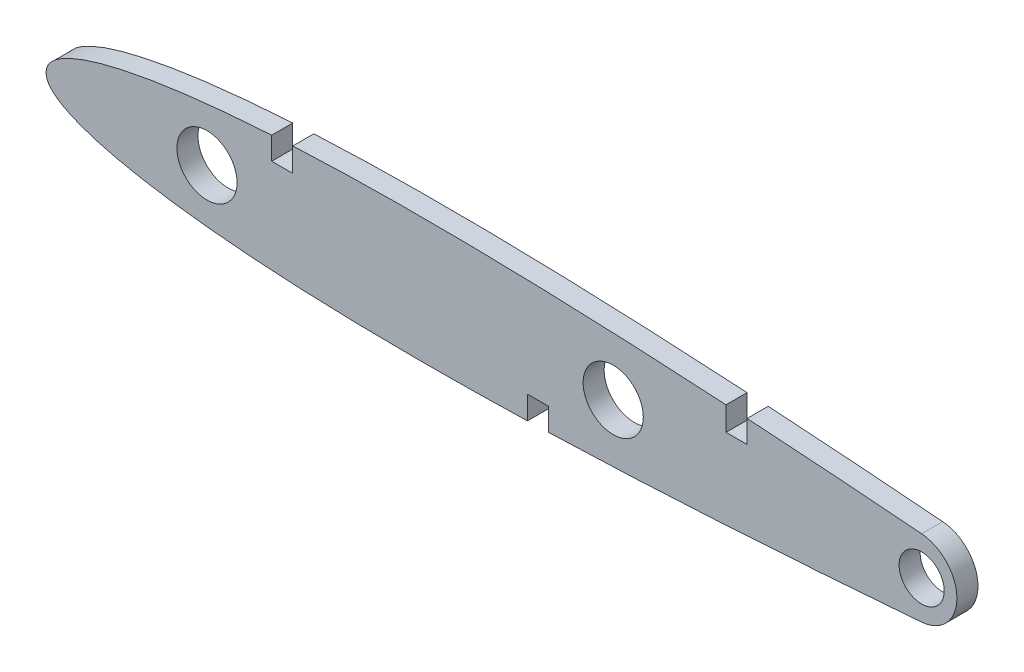
from build123d import *

# Parameters (mm, degrees)
SKETCH_1_R      = 4
SKETCH_1_R_2    = 3
EXTRUDE_1_DEPTH = 1.4


with BuildPart() as part:
    # Эскиз1 → Бобышка-Вытянуть1 (new, symmetric)
    # profile 1 of 3: a face of its own
    with BuildSketch(Plane.XY):
        with BuildLine():
            ThreePointArc((142.879654521, -5.645889143), (140.91290042, 0), (142.879654521, 5.645889143))
            add(Edge.make_bspline(
                [(142.879654521, 5.645889143), (142.747268556, 5.655935735), (140.983089587, 5.789556497), (137.585492165, 6.040187447), (132.68922042, 6.382393711), (129.093359344, 6.61888416), (127.131231234, 6.742693318), (126.8, 6.763442063)],
                knots=[0.339950039, 0.339950039, 0.339950039, 0.339950039, 0.342309554, 0.371392651, 0.400495753, 0.429537687, 0.435435831, 0.435435831, 0.435435831, 0.435435831], degree=3))
            Line((126.8, 6.763442063), (126.8, 3.763442063))
            Line((126.8, 3.763442063), (124, 3.763442063))
            Line((124, 3.763442063), (124, 6.935165252))
            add(Edge.make_bspline(
                [(124, 6.935165252), (123.641212233, 6.956691636), (121.670677761, 7.073894152), (118.103435227, 7.275698401), (113.316671904, 7.521871639), (108.586398202, 7.738792494), (103.923211277, 7.924514665), (99.337253306, 8.077210344), (94.83828356, 8.195186848), (90.435677893, 8.276886408), (86.138497273, 8.320981466), (81.955490955, 8.326384834), (77.89513162, 8.292131727), (73.965623193, 8.217718888), (70.174939177, 8.10268745), (67.668791632, 7.99564794), (66.426868705, 7.933879191), (66.4, 7.93253874)],
                knots=[0.452054102, 0.452054102, 0.452054102, 0.452054102, 0.458441906, 0.487136114, 0.515551917, 0.543623847, 0.571289985, 0.59849081, 0.625169613, 0.651272029, 0.676746158, 0.701541791, 0.725611017, 0.748907835, 0.771387785, 0.793008139, 0.793486237, 0.793486237, 0.793486237, 0.793486237], degree=3))
            Line((66.4, 7.93253874), (66.4, 4.777447755))
            Line((66.4, 4.777447755), (63.6, 4.777447755))
            Line((63.6, 4.777447755), (63.6, 7.777447755))
            add(Edge.make_bspline(
                [(63.6, 7.777447755), (63.396162512, 7.764994786), (62.081509824, 7.682983398), (59.712211754, 7.515019975), (56.552200858, 7.239849215), (53.56772758, 6.926570619), (50.765590148, 6.57637304), (48.152410031, 6.190731972), (45.734630901, 5.771261543), (43.518525859, 5.319707647), (41.510178464, 4.837901503), (39.715362287, 4.3277629), (38.139724526, 3.791042715), (36.787821083, 3.229441513), (35.665157045, 2.644102252), (34.771002159, 2.034538769), (34.118995376, 1.396849457), (33.68372682, 0.718681816), (33.626994167, 0.231708516), (33.6, 0)],
                knots=[0.810098727, 0.810098727, 0.810098727, 0.810098727, 0.813728033, 0.833507815, 0.852309696, 0.87009731, 0.886835918, 0.902492782, 0.917037139, 0.930441054, 0.942679762, 0.953733567, 0.963589785, 0.972247019, 0.979722225, 0.986065145, 0.991385258, 0.995900989, 1, 1, 1, 1], degree=3))
            add(Edge.make_bspline(
                [(33.6, 0), (33.626994167, -0.231708516), (33.68372682, -0.718681816), (34.118995376, -1.396849457), (34.771002159, -2.034538769), (35.665157045, -2.644102252), (36.787821083, -3.229441513), (38.139724526, -3.791042715), (39.715362287, -4.3277629), (41.510178464, -4.837901503), (43.518525859, -5.319707647), (45.734630901, -5.771261543), (48.152410031, -6.190731972), (50.765590148, -6.57637304), (53.56772758, -6.926570619), (56.552200858, -7.239849215), (59.712211754, -7.515019975), (63.040803104, -7.750989271), (66.530820659, -7.947044314), (70.174939177, -8.10268745), (73.965623193, -8.217718888), (77.89513162, -8.292131727), (81.955490955, -8.326384834), (86.138497273, -8.320981466), (90.435677893, -8.276886408), (94.268903337, -8.20575289), (96.668631576, -8.146352686), (97.6, -8.121192528)],
                knots=[0, 0, 0, 0, 0.004099011, 0.008614742, 0.013934855, 0.020277775, 0.027752981, 0.036410215, 0.046266433, 0.057320238, 0.069558946, 0.082962861, 0.097507218, 0.113164082, 0.12990269, 0.147690304, 0.166492185, 0.186271967, 0.206991861, 0.228612215, 0.251092165, 0.274388983, 0.298458209, 0.323253842, 0.348727971, 0.374830387, 0.391388582, 0.391388582, 0.391388582, 0.391388582], degree=3))
            Line((97.6, -8.121192528), (97.6, -5.039340517))
            Line((97.6, -5.039340517), (100.4, -5.039340517))
            Line((100.4, -5.039340517), (100.4, -8.039340517))
            add(Edge.make_bspline(
                [(100.400000001, -8.039340517), (101.56572059, -8.002730044), (104.287183669, -7.910018625), (108.586398202, -7.738792494), (113.316671904, -7.521871639), (118.103435227, -7.275698401), (122.935626987, -7.002334081), (127.801626972, -6.703838046), (132.68922042, -6.382393711), (137.585492165, -6.040187447), (140.983089587, -5.789556497), (142.747268556, -5.655935735), (142.879654521, -5.645889143)],
                knots=[0.40798276, 0.40798276, 0.40798276, 0.40798276, 0.428710015, 0.456376153, 0.484448083, 0.512863886, 0.541558094, 0.570462313, 0.599504247, 0.628607349, 0.657690446, 0.660049961, 0.660049961, 0.660049961, 0.660049961], degree=3))
        make_face()
        with Locations((55, 0)):
            Circle(SKETCH_1_R, mode=Mode.SUBTRACT)
        with Locations((109, 0)):
            Circle(SKETCH_1_R, mode=Mode.SUBTRACT)
    # profile 2 of 3: a face of its own
    with BuildSketch(Plane.XY):
        with BuildLine():
            ThreePointArc((150, -5.087100899), (144.91290042, 0), (150, 5.087100899))
            add(Edge.make_bspline(
                [(150, 5.087100899), (149.119852039, 5.158405472), (146.746701571, 5.348471448), (144.373077342, 5.532555307), (142.879654521, 5.645889143)],
                knots=[0.297639613, 0.297639613, 0.297639613, 0.297639613, 0.313332763, 0.339950039, 0.339950039, 0.339950039, 0.339950039], degree=3))
            ThreePointArc((142.879654521, 5.645889143), (140.91290042, 0), (142.879654521, -5.645889143))
            add(Edge.make_bspline(
                [(142.879654521, -5.645889143), (144.373077342, -5.532555307), (146.746701571, -5.348471448), (149.119852039, -5.158405472), (150, -5.087100899)],
                knots=[0.660049961, 0.660049961, 0.660049961, 0.660049961, 0.686667237, 0.702360387, 0.702360387, 0.702360387, 0.702360387], degree=3))
        make_face()
    # profile 3 of 3: a face of its own
    with BuildSketch(Plane.XY):
        with BuildLine():
            ThreePointArc((150, 5.087100899), (144.91290042, 0), (150, -5.087100899))
            ThreePointArc((150, -5.087100899), (154.691639791, 0), (150, 5.087100899))
        make_face()
        with Locations((150.000001319, 0)):
            Circle(SKETCH_1_R_2, mode=Mode.SUBTRACT)
    extrude(amount=EXTRUDE_1_DEPTH, both=True)


solid = part.part
